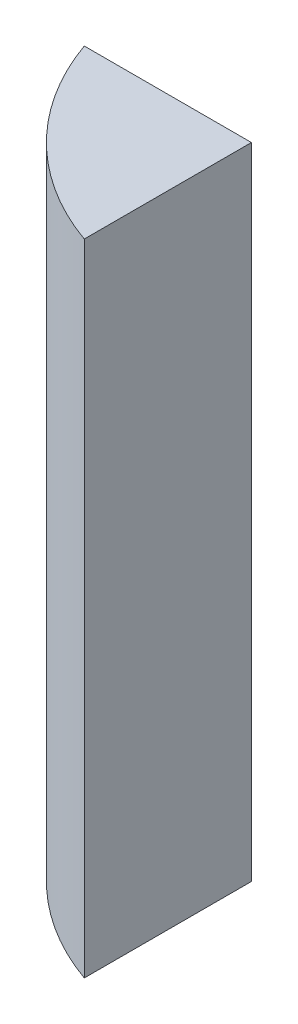
from build123d import *

# Parameters (mm, degrees)
EXTRUDE_1_DEPTH = 140


with BuildPart() as part:
    # 草图1 → 凸台-拉伸1 (new body)
    with BuildSketch(Plane(origin=(0, 0, 0), x_dir=(1, 0, 0), z_dir=(0, 1, 0))):
        with BuildLine():
            Line((-20, -20), (-56.568542495, -20))
            ThreePointArc((-56.568542495, -20), (-42.426406871, -42.426406871), (-20, -56.568542495))
            Line((-20, -56.568542495), (-20, -20))
        make_face()
    extrude(amount=EXTRUDE_1_DEPTH)


solid = part.part
